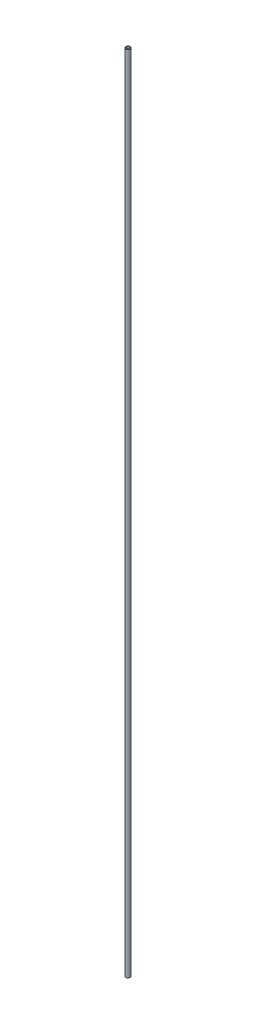
from build123d import *

# Parameters (mm, degrees)
SKETCH1_R           = 24.13
SKETCH1_R_2         = 19.05
BOSS_EXTRUDE1_DEPTH = 9144


with BuildPart() as part:
    # Sketch1 → Boss-Extrude1 (new body)
    with BuildSketch(Plane(origin=(0, 0, 0), x_dir=(1, 0, 0), z_dir=(0, 1, 0))):
        with Locations(Location((0, 0, 0), (0, 0, 270))):
            Circle(SKETCH1_R)
        with Locations(Location((0, 0, 0), (0, 0, 270))):
            Circle(SKETCH1_R_2, mode=Mode.SUBTRACT)
    extrude(amount=BOSS_EXTRUDE1_DEPTH)


solid = part.part
